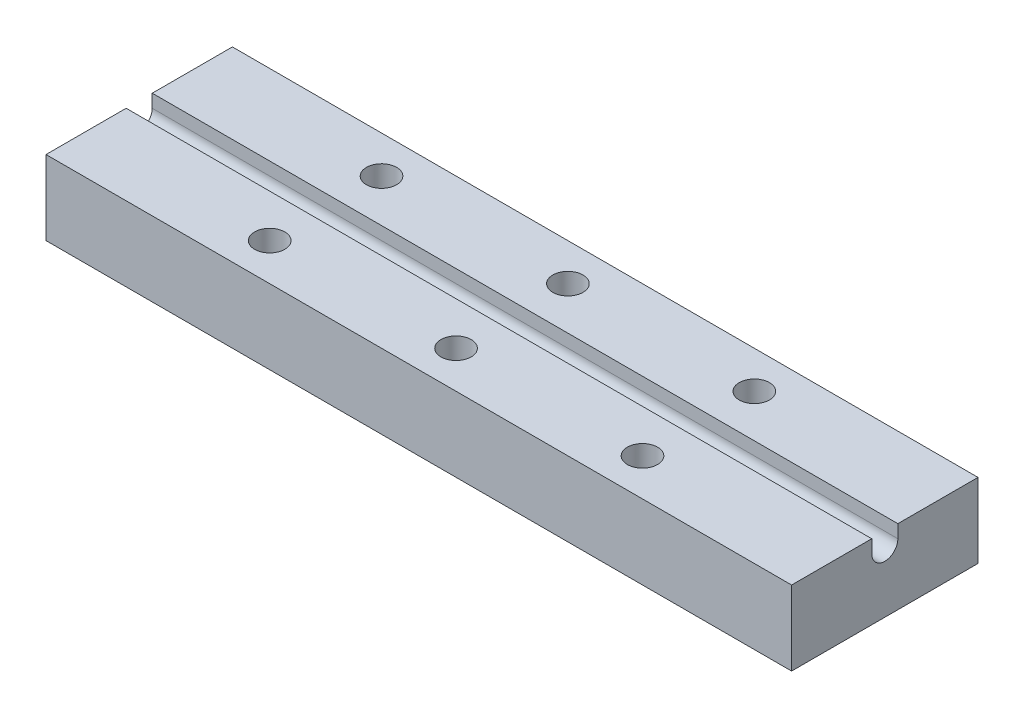
from build123d import *

# Parameters (mm, degrees)
SKETCH1_W               = 200
SKETCH1_H               = 50
BOSS_EXTRUDE1_DEPTH     = 20
CUT_EXTRUDE1_DEPTH      = 30
CUT_EXTRUDE1_DEPTH_BACK = 221
SKETCH3_R               = 4.05
CUT_EXTRUDE2_DEPTH      = 67


with BuildPart() as part:
    # Sketch1 → Boss-Extrude1 (new body)
    with BuildSketch(Plane(origin=(0, 0, 0), x_dir=(1, 0, 0), z_dir=(0, 1, 0))):
        with Locations((100, 25)):
            Rectangle(SKETCH1_W, SKETCH1_H)
    extrude(amount=BOSS_EXTRUDE1_DEPTH)

    # Sketch2 → Cut-Extrude1 (cut, two sides: drawn at the far end of the back side and taken through both)
    with BuildSketch(Plane.ZY.offset(-CUT_EXTRUDE1_DEPTH_BACK)):
        with BuildLine():
            Line((-25, 20), (-28.5, 20))
            Line((-28.5, 20), (-28.5, 16.5))
            ThreePointArc((-28.5, 16.5), (-27.474873734, 18.974873734), (-25, 20))
        make_face()
        with BuildLine():
            ThreePointArc((-21.5, 16.5), (-22.525126266, 18.974873734), (-25, 20))
            Line((-25, 20), (-25, 13))
            ThreePointArc((-25, 13), (-22.525126266, 14.025126266), (-21.5, 16.5))
        make_face()
        with BuildLine():
            Line((-25, 13), (-25, 20))
            ThreePointArc((-25, 20), (-27.474873734, 18.974873734), (-28.5, 16.5))
            ThreePointArc((-28.5, 16.5), (-27.474873734, 14.025126266), (-25, 13))
        make_face()
        with BuildLine():
            Line((-21.5, 20), (-25, 20))
            ThreePointArc((-25, 20), (-22.525126266, 18.974873734), (-21.5, 16.5))
            Line((-21.5, 16.5), (-21.5, 20))
        make_face()
    extrude(amount=CUT_EXTRUDE1_DEPTH + CUT_EXTRUDE1_DEPTH_BACK, mode=Mode.SUBTRACT)

    # Sketch3 → Cut-Extrude2 (cut)
    with BuildSketch(Plane.XZ):
        with BuildLine():
            ThreePointArc((104.05, -10), (102.863782464, -7.136217536), (100, -5.95))
            Line((100, -5.95), (100, -14.05))
            ThreePointArc((100, -14.05), (102.863782464, -12.863782464), (104.05, -10))
        make_face()
        with BuildLine():
            Line((100, -14.05), (100, -5.95))
            ThreePointArc((100, -5.95), (95.95, -10), (100, -14.05))
        make_face()
        with BuildLine():
            ThreePointArc((54.05, -10), (52.863782464, -7.136217536), (50, -5.95))
            Line((50, -5.95), (50, -14.05))
            ThreePointArc((50, -14.05), (52.863782464, -12.863782464), (54.05, -10))
        make_face()
        with BuildLine():
            Line((50, -14.05), (50, -5.95))
            ThreePointArc((50, -5.95), (45.95, -10), (50, -14.05))
        make_face()
        with Locations(Location((50, -40, 0), (0, 0, 270))):
            Circle(SKETCH3_R)
        with Locations(Location((100, -40, 0), (0, 0, 270))):
            Circle(SKETCH3_R)
        with Locations(Location((150, -40, 0), (0, 0, 270))):
            Circle(SKETCH3_R)
        with Locations(Location((150, -10, 0), (0, 0, 270))):
            Circle(SKETCH3_R)
    extrude(amount=-CUT_EXTRUDE2_DEPTH, mode=Mode.SUBTRACT)


solid = part.part
